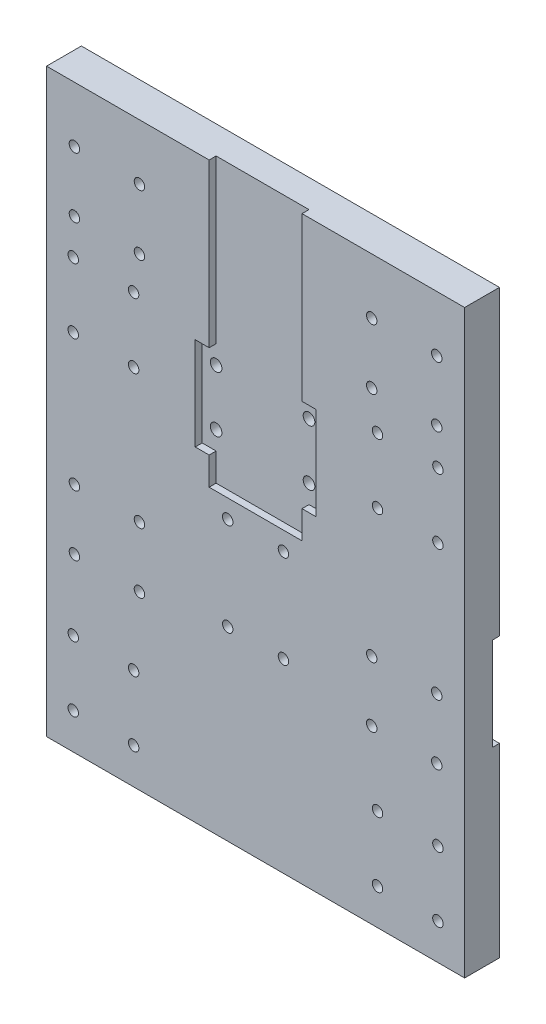
from build123d import *

# Parameters (mm, degrees)
ESQUISSE1_W             = 180
ESQUISSE1_H             = 250
BOSS_EXTRU_1_DEPTH      = 15
ESQUISSE2_R             = 2.25
ENL_V_MAT_EXTRU_1_DEPTH = 15
ESQUISSE3_R             = 2.25
ENL_V_MAT_EXTRU_2_DEPTH = 15
ESQUISSE6_W             = 40
ESQUISSE6_H             = 52
ENL_V_MAT_EXTRU_4_DEPTH = 3
ESQUISSE4_W             = 39
ESQUISSE4_H             = 40
ESQUISSE4_W_2           = 12
ENL_V_MAT_EXTRU_3_DEPTH = 3
ENL_V_START             = -15
ESQUISSE7_R             = 2.5
ENL_V_MAT_EXTRU_5_DEPTH = 15
ESQUISSE8_W             = 52
ESQUISSE8_H             = 40
ENL_V_MAT_EXTRU_6_DEPTH = 3
ESQUISSE9_W             = 40
ESQUISSE9_H             = 12
ENL_V_MAT_EXTRU_7_DEPTH = 3
ESQUISSE10_W            = 40
ESQUISSE10_H            = 60
ENL_V_MAT_EXTRU_8_DEPTH = 3
ESQUISSE11_W            = 58.5
ESQUISSE11_H            = 40
ENL_V_MAT_EXTRU_9_DEPTH = 3


with BuildPart() as part:
    # Esquisse1 → Boss.-Extru.1 (new body)
    with BuildSketch(Plane.XY):
        with Locations((90, 125)):
            Rectangle(ESQUISSE1_W, ESQUISSE1_H)
    extrude(amount=BOSS_EXTRU_1_DEPTH)

    # Esquisse2 → Enlèv. mat.-Extru.1 (cut)
    with BuildSketch(Plane.XY.offset(15)):
        with Locations((11.5, 184.5)):
            Circle(ESQUISSE2_R)
        with Locations((37.5, 184.5)):
            Circle(ESQUISSE2_R)
        with Locations((37.5, 156.5)):
            Circle(ESQUISSE2_R)
        with Locations((11.5, 156.5)):
            Circle(ESQUISSE2_R)
        with Locations(Location((168.5, 156.5, 0), (0, 0, 180))):
            Circle(ESQUISSE2_R)
        with Locations(Location((142.5, 156.5, 0), (0, 0, 180))):
            Circle(ESQUISSE2_R)
        with Locations(Location((142.5, 184.5, 0), (0, 0, 180))):
            Circle(ESQUISSE2_R)
        with Locations(Location((168.5, 184.5, 0), (0, 0, 180))):
            Circle(ESQUISSE2_R)
        with Locations((168.5, 15.5)):
            Circle(ESQUISSE2_R)
        with Locations((142.5, 15.5)):
            Circle(ESQUISSE2_R)
        with Locations((142.5, 43.5)):
            Circle(ESQUISSE2_R)
        with Locations((168.5, 43.5)):
            Circle(ESQUISSE2_R)
        with Locations(Location((11.5, 43.5, 0), (0, 0, 180))):
            Circle(ESQUISSE2_R)
        with Locations(Location((37.5, 43.5, 0), (0, 0, 180))):
            Circle(ESQUISSE2_R)
        with Locations(Location((37.5, 15.5, 0), (0, 0, 180))):
            Circle(ESQUISSE2_R)
        with Locations(Location((11.5, 15.5, 0), (0, 0, 180))):
            Circle(ESQUISSE2_R)
        with Locations((78, 120)):
            Circle(ESQUISSE2_R)
        with Locations(Location((78, 80, 0), (0, 0, 180))):
            Circle(ESQUISSE2_R)
        with Locations((102, 80)):
            Circle(ESQUISSE2_R)
        with Locations(Location((102, 120, 0), (0, 0, 180))):
            Circle(ESQUISSE2_R)
    extrude(amount=-ENL_V_MAT_EXTRU_1_DEPTH, mode=Mode.SUBTRACT)

    # Esquisse3 → Enlèv. mat.-Extru.2 (cut)
    with BuildSketch(Plane.XY.offset(15)):
        with Locations((12, 226)):
            Circle(ESQUISSE3_R)
        with Locations((40, 226)):
            Circle(ESQUISSE3_R)
        with Locations((12, 200)):
            Circle(ESQUISSE3_R)
        with Locations((40, 200)):
            Circle(ESQUISSE3_R)
        with Locations(Location((140, 200, 0), (0, 0, 180))):
            Circle(ESQUISSE3_R)
        with Locations(Location((168, 200, 0), (0, 0, 180))):
            Circle(ESQUISSE3_R)
        with Locations(Location((140, 226, 0), (0, 0, 180))):
            Circle(ESQUISSE3_R)
        with Locations(Location((168, 226, 0), (0, 0, 180))):
            Circle(ESQUISSE3_R)
        with Locations((168, 74)):
            Circle(ESQUISSE3_R)
        with Locations((140, 74)):
            Circle(ESQUISSE3_R)
        with Locations((168, 100)):
            Circle(ESQUISSE3_R)
        with Locations((140, 100)):
            Circle(ESQUISSE3_R)
        with Locations(Location((40, 100, 0), (0, 0, 180))):
            Circle(ESQUISSE3_R)
        with Locations(Location((12, 100, 0), (0, 0, 180))):
            Circle(ESQUISSE3_R)
        with Locations(Location((40, 74, 0), (0, 0, 180))):
            Circle(ESQUISSE3_R)
        with Locations(Location((12, 74, 0), (0, 0, 180))):
            Circle(ESQUISSE3_R)
    extrude(amount=-ENL_V_MAT_EXTRU_2_DEPTH, mode=Mode.SUBTRACT)

    # Esquisse6 → Enlèv. mat.-Extru.4 (cut)
    with BuildSketch(Plane(origin=(0, 0, 0), x_dir=(-1, 0, 0), z_dir=(0, 0, -1))):
        with Locations((-90, 100)):
            Rectangle(ESQUISSE6_W, ESQUISSE6_H)
    extrude(amount=-ENL_V_MAT_EXTRU_4_DEPTH, mode=Mode.SUBTRACT)

    # Esquisse4 → Enlèv. mat.-Extru.3 (cut)
    with BuildSketch(Plane(origin=(0, 0, 0), x_dir=(-1, 0, 0), z_dir=(0, 0, -1))):
        with Locations((-155.5, 170.5)):
            Rectangle(ESQUISSE4_W, ESQUISSE4_H)
        with Locations((-155.5, 29.5)):
            Rectangle(ESQUISSE4_W, ESQUISSE4_H)
        with Locations((-24.5, 29.5)):
            Rectangle(ESQUISSE4_W, ESQUISSE4_H)
        with Locations((-24.5, 170.5)):
            Rectangle(ESQUISSE4_W, ESQUISSE4_H)
        with Locations((-115.5, 100)):
            Rectangle(ESQUISSE4_W_2, ESQUISSE4_H)
        with Locations((-64.5, 100)):
            Rectangle(ESQUISSE4_W_2, ESQUISSE4_H)
    extrude(amount=-ENL_V_MAT_EXTRU_3_DEPTH, mode=Mode.SUBTRACT)

    # Esquisse7 → Enlèv. mat.-Extru.5 (cut)
    with BuildSketch(Plane.XY.offset(15).offset(ENL_V_START)):
        with Locations((70, 172)):
            Circle(ESQUISSE7_R)
        with Locations(Location((110, 172, 0), (0, 0, 180))):
            Circle(ESQUISSE7_R)
        with Locations((110, 148)):
            Circle(ESQUISSE7_R)
        with Locations(Location((70, 148, 0), (0, 0, 180))):
            Circle(ESQUISSE7_R)
    extrude(amount=ENL_V_MAT_EXTRU_5_DEPTH, mode=Mode.SUBTRACT)

    # Esquisse8 → Enlèv. mat.-Extru.6 (cut)
    with BuildSketch(Plane.XY.offset(15)):
        with Locations((90, 160)):
            Rectangle(ESQUISSE8_W, ESQUISSE8_H)
    extrude(amount=-ENL_V_MAT_EXTRU_6_DEPTH, mode=Mode.SUBTRACT)

    # Esquisse9 → Enlèv. mat.-Extru.7 (cut)
    with BuildSketch(Plane.XY.offset(15)):
        with Locations((90, 134)):
            Rectangle(ESQUISSE9_W, ESQUISSE9_H)
        with Locations((90, 186)):
            Rectangle(ESQUISSE9_W, ESQUISSE9_H)
    extrude(amount=-ENL_V_MAT_EXTRU_7_DEPTH, mode=Mode.SUBTRACT)

    # Esquisse10 → Enlèv. mat.-Extru.8 (cut)
    with BuildSketch(Plane.XY.offset(15)):
        with Locations((90, 220)):
            Rectangle(ESQUISSE10_W, ESQUISSE10_H)
    extrude(amount=-ENL_V_MAT_EXTRU_8_DEPTH, mode=Mode.SUBTRACT)

    # Esquisse11 → Enlèv. mat.-Extru.9 (cut)
    with BuildSketch(Plane(origin=(0, 0, 0), x_dir=(-1, 0, 0), z_dir=(0, 0, -1))):
        with Locations((-29.25, 100)):
            Rectangle(ESQUISSE11_W, ESQUISSE11_H)
        with Locations((-150.75, 100)):
            Rectangle(ESQUISSE11_W, ESQUISSE11_H)
    extrude(amount=-ENL_V_MAT_EXTRU_9_DEPTH, mode=Mode.SUBTRACT)


solid = part.part
